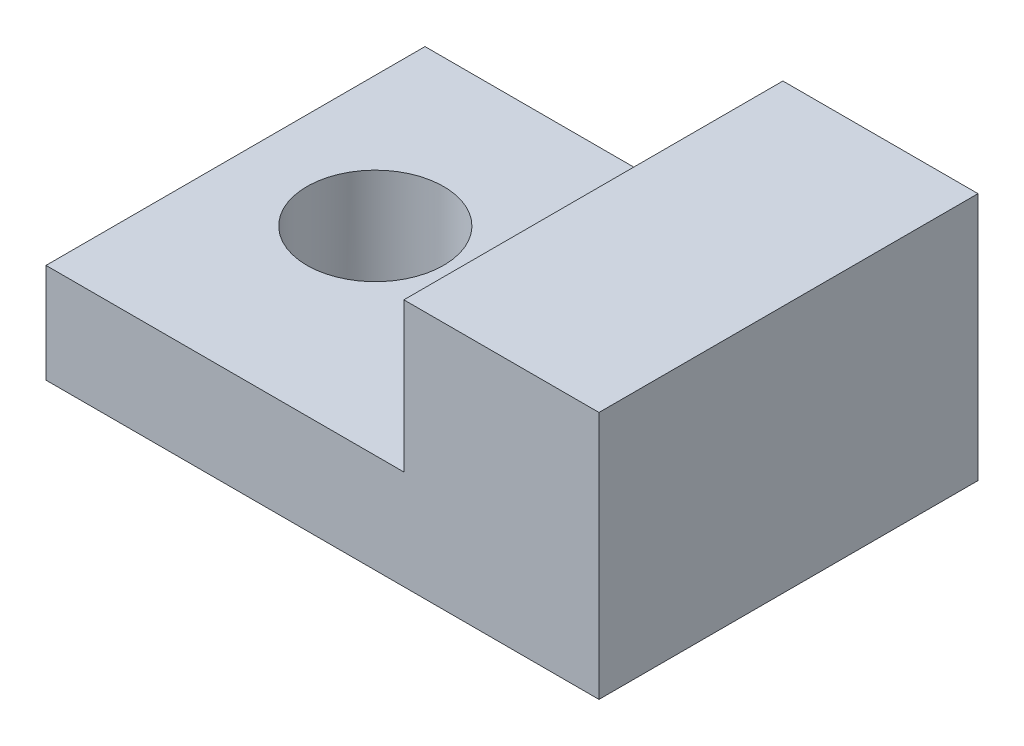
from build123d import *

# Parameters (mm, degrees)
SKETCH1_W           = 17.6609375
SKETCH1_H           = 12.1046875
BOSS_EXTRUDE1_DEPTH = 7.9375
SKETCH2_W           = 11.43
SKETCH2_H           = 4.7625
CUT_EXTRUDE1_DEPTH  = 25.4
SKETCH3_R           = 2.1828125
CUT_EXTRUDE2_DEPTH  = 25.4


with BuildPart() as part:
    # Sketch1 → Boss-Extrude1 (new body)
    with BuildSketch(Plane(origin=(0, 0, 0), x_dir=(1, 0, 0), z_dir=(0, 1, 0))):
        with Locations((8.83046875, 6.05234375)):
            Rectangle(SKETCH1_W, SKETCH1_H)
    extrude(amount=BOSS_EXTRUDE1_DEPTH)

    # Sketch2 → Cut-Extrude1 (cut)
    with BuildSketch(Plane.XY):
        with Locations((5.715, 5.55625)):
            Rectangle(SKETCH2_W, SKETCH2_H)
    extrude(amount=-CUT_EXTRUDE1_DEPTH, mode=Mode.SUBTRACT)

    # Sketch3 → Cut-Extrude2 (cut)
    with BuildSketch(Plane(origin=(0, 3.175, 0), x_dir=(1, 0, 0), z_dir=(0, 1, 0))):
        with Locations(Location((4.1671875, 6.35, 0), (0, 0, 270))):
            Circle(SKETCH3_R)
    extrude(amount=-CUT_EXTRUDE2_DEPTH, mode=Mode.SUBTRACT)


solid = part.part
